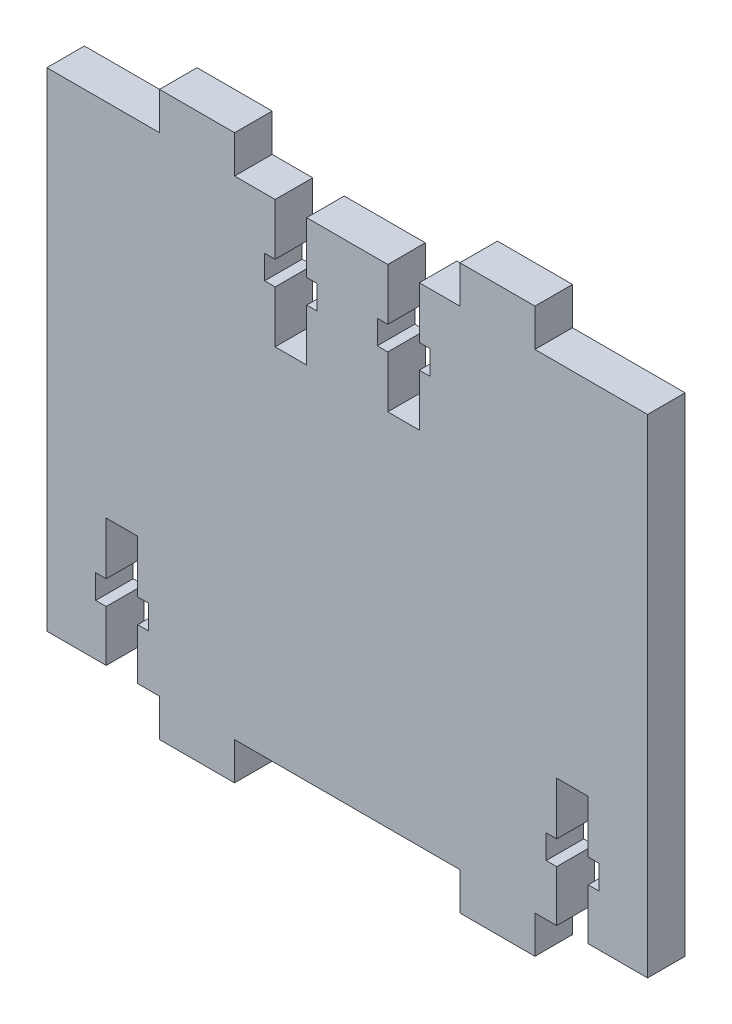
from build123d import *

# Parameters (mm, degrees)
BOSS_EXTRUDE1_DEPTH = 5


with BuildPart() as part:
    # Sketch1 → Boss-Extrude1 (new body)
    with BuildSketch(Plane.XY):
        Polygon((-17.034366274, 26.630625459), (-32.034366274, 26.630625459), (-32.034366274, -38.369374541), (-24.134366274, -38.369374541), (-24.134366274, -31.569374541), (-25.534366274, -31.569374541), (-25.534366274, -28.369374541), (-24.134366274, -28.369374541), (-24.134366274, -21.369374541), (-19.934366274, -21.369374541), (-19.934366274, -28.369374541), (-18.534366274, -28.369374541), (-18.534366274, -31.569374541), (-19.934366274, -31.569374541), (-19.934366274, -38.369374541), (-17.034366274, -38.369374541), (-17.034366274, -43.369374541), (-7.034366274, -43.369374541), (-7.034366274, -38.369374541), (22.965633726, -38.369374541), (22.965633726, -43.369374541), (32.965633726, -43.369374541), (32.965633726, -38.369374541), (35.865633726, -38.369374541), (35.865633726, -31.569374541), (34.465633726, -31.569374541), (34.465633726, -28.369374541), (35.865633726, -28.369374541), (35.865633726, -21.369374541), (40.065633726, -21.369374541), (40.065633726, -28.369374541), (41.465633726, -28.369374541), (41.465633726, -31.569374541), (40.065633726, -31.569374541), (40.065633726, -38.369374541), (47.965633726, -38.369374541), (47.965633726, 26.630625459), (32.965633726, 26.630625459), (32.965633726, 31.630625459), (22.965633726, 31.630625459), (22.965633726, 26.630625459), (17.565633726, 26.630625459), (17.565633726, 19.730625459), (18.965633726, 19.730625459), (18.965633726, 16.543629904), (17.565633726, 16.543629904), (17.565633726, 9.630625459), (13.365633726, 9.630625459), (13.365633726, 16.543629904), (11.965633726, 16.543629904), (11.965633726, 19.730625459), (13.365633726, 19.730625459), (13.365633726, 26.630625459), (2.565633726, 26.630625459), (2.565633726, 19.730625459), (3.965633726, 19.730625459), (3.965633726, 16.543629904), (2.565633726, 16.543629904), (2.565633726, 9.630625459), (-1.634366274, 9.630625459), (-1.634366274, 16.543629904), (-3.034366274, 16.543629904), (-3.034366274, 19.730625459), (-1.634366274, 19.730625459), (-1.634366274, 26.630625459), (-7.034366274, 26.630625459), (-7.034366274, 31.630625459), (-17.034366274, 31.630625459), align=None)
    extrude(amount=BOSS_EXTRUDE1_DEPTH)


solid = part.part
